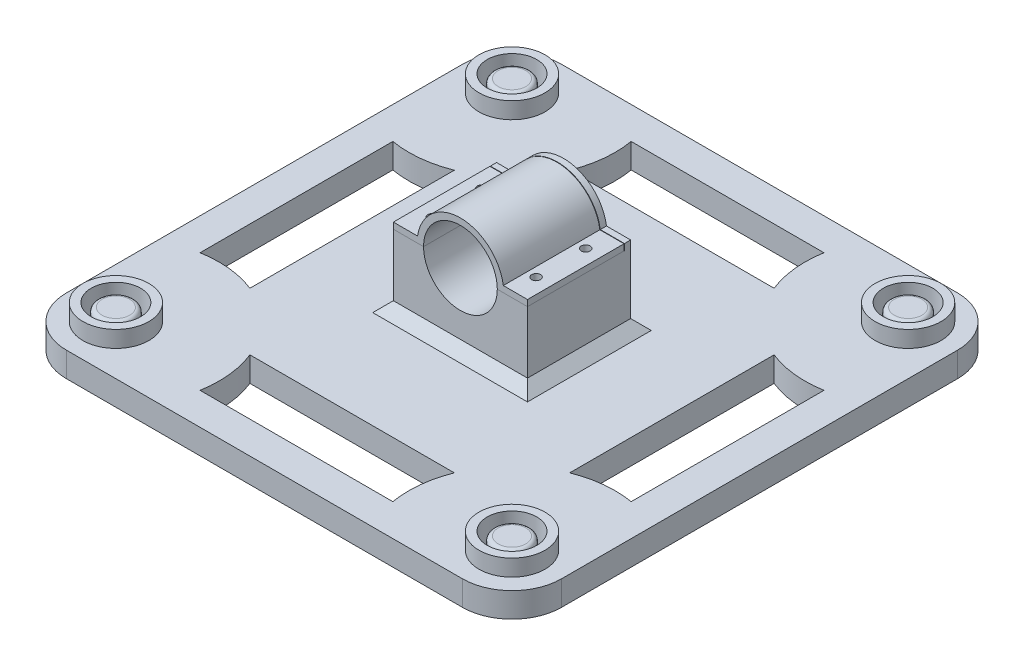
from build123d import *

# Parameters (mm, degrees)
SKETCH1_R           = 12
BOSS_EXTRUDE1_DEPTH = 12
SKETCH1_3_R         = 12
SKETCH1_3_R_2       = 8.7
BOSS_EXTRUDE2_DEPTH = 6
SKETCH1_4_R         = 8.7
BOSS_EXTRUDE3_DEPTH = 18
FILLET1_R           = 2
SKETCH2_R           = 16
SKETCH2_R_2         = 12
BOSS_EXTRUDE4_DEPTH = 8
SKETCH3_W           = 65
SKETCH3_H           = 15
BOSS_EXTRUDE5_DEPTH = 35
SKETCH10_W          = 65
SKETCH10_H          = 20
BOSS_EXTRUDE6_DEPTH = 35
SKETCH4_R           = 17.875
CUT_EXTRUDE1_DEPTH  = 49
CHAMFER1_SIZE       = 5
BOSS_EXTRUDE7_START = -3
SKETCH11_R          = 17.875
BOSS_EXTRUDE7_DEPTH = 3
SKETCH9_R           = 2.15
CUT_EXTRUDE2_DEPTH  = 8
SKETCH13_R          = 6.6
CUT_EXTRUDE3_DEPTH  = 8
SKETCH14_R          = 1.6
CUT_EXTRUDE4_DEPTH  = 8
BOSS_EXTRUDE8_DEPTH = 46.8
SKETCH16_R          = 2.15
CUT_EXTRUDE5_DEPTH  = 5.2
BOSS_EXTRUDE9_START = -3
BOSS_EXTRUDE9_DEPTH = 3
CUT_EXTRUDE6_DEPTH  = 26.2


with BuildPart() as part:
    # Sketch1 → Boss-Extrude1 (new body)
    with BuildSketch(Plane(origin=(0, 0, 0), x_dir=(1, 0, 0), z_dir=(0, 1, 0))):
        with BuildLine():
            ThreePointArc((0, 216), (7.029437252, 232.970562748), (24, 240))
            Line((24, 240), (216, 240))
            ThreePointArc((216, 240), (232.970562748, 232.970562748), (240, 216))
            Line((240, 216), (240, 24))
            ThreePointArc((240, 24), (232.970562748, 7.029437252), (216, 0))
            Line((216, 0), (24, 0))
            ThreePointArc((24, 0), (7.029437252, 7.029437252), (0, 24))
            Line((0, 24), (0, 216))
        make_face()
        with Locations(Location((24, 24, 0), (0, 0, 270))):
            Circle(SKETCH1_R, mode=Mode.SUBTRACT)
        with Locations(Location((216, 24, 0), (0, 0, 270))):
            Circle(SKETCH1_R, mode=Mode.SUBTRACT)
        with Locations(Location((216, 216, 0), (0, 0, 270))):
            Circle(SKETCH1_R, mode=Mode.SUBTRACT)
        with Locations(Location((24, 216, 0), (0, 0, 270))):
            Circle(SKETCH1_R, mode=Mode.SUBTRACT)
    extrude(amount=BOSS_EXTRUDE1_DEPTH)

    # Sketch1<3> → Boss-Extrude2 (add)
    # profile 1 of 4: a face of its own
    with BuildSketch(Plane(origin=(0, 0, 0), x_dir=(1, 0, 0), z_dir=(0, 1, 0))):
        with Locations(Location((24, 24, 0), (0, 0, 270))):
            Circle(SKETCH1_3_R)
        with Locations(Location((24, 24, 0), (0, 0, 270))):
            Circle(SKETCH1_3_R_2, mode=Mode.SUBTRACT)
    # profile 2 of 4: a face of its own
    with BuildSketch(Plane(origin=(0, 0, 0), x_dir=(1, 0, 0), z_dir=(0, 1, 0))):
        with Locations(Location((24, 216, 0), (0, 0, 270))):
            Circle(SKETCH1_3_R)
        with Locations(Location((24, 216, 0), (0, 0, 270))):
            Circle(SKETCH1_3_R_2, mode=Mode.SUBTRACT)
    # profile 3 of 4: a face of its own
    with BuildSketch(Plane(origin=(0, 0, 0), x_dir=(1, 0, 0), z_dir=(0, 1, 0))):
        with Locations(Location((216, 216, 0), (0, 0, 270))):
            Circle(SKETCH1_3_R)
        with Locations(Location((216, 216, 0), (0, 0, 270))):
            Circle(SKETCH1_3_R_2, mode=Mode.SUBTRACT)
    # profile 4 of 4: a face of its own
    with BuildSketch(Plane(origin=(0, 0, 0), x_dir=(1, 0, 0), z_dir=(0, 1, 0))):
        with Locations(Location((216, 24, 0), (0, 0, 270))):
            Circle(SKETCH1_3_R)
        with Locations(Location((216, 24, 0), (0, 0, 270))):
            Circle(SKETCH1_3_R_2, mode=Mode.SUBTRACT)
    extrude(amount=BOSS_EXTRUDE2_DEPTH)

    # Sketch1<4> → Boss-Extrude3 (add)
    with BuildSketch(Plane(origin=(0, 0, 0), x_dir=(1, 0, 0), z_dir=(0, 1, 0))):
        with Locations(Location((216, 216, 0), (0, 0, 270))):
            Circle(SKETCH1_4_R)
        with Locations(Location((216, 24, 0), (0, 0, 270))):
            Circle(SKETCH1_4_R)
        with Locations(Location((24, 24, 0), (0, 0, 270))):
            Circle(SKETCH1_4_R)
        with Locations(Location((24, 216, 0), (0, 0, 270))):
            Circle(SKETCH1_4_R)
    extrude(amount=BOSS_EXTRUDE3_DEPTH)

    # Fillet1
    fillet1_edges = [part.edges().sort_by_distance(p)[0] for p in [
        (216, 18, -224.7),
        (216, 18, -32.7),
        (24, 18, -32.7),
        (24, 18, -224.7),
    ]]
    fillet(fillet1_edges, radius=FILLET1_R)

    # Sketch2 → Boss-Extrude4 (add)
    # profile 1 of 4: a face of its own
    with BuildSketch(Plane(origin=(0, 12, 0), x_dir=(1, 0, 0), z_dir=(0, 1, 0))):
        with Locations(Location((24, 24, 0), (0, 0, 270))):
            Circle(SKETCH2_R)
        with Locations(Location((24, 24, 0), (0, 0, 270))):
            Circle(SKETCH2_R_2, mode=Mode.SUBTRACT)
    # profile 2 of 4: a face of its own
    with BuildSketch(Plane(origin=(0, 12, 0), x_dir=(1, 0, 0), z_dir=(0, 1, 0))):
        with Locations(Location((216, 24, 0), (0, 0, 270))):
            Circle(SKETCH2_R)
        with Locations(Location((216, 24, 0), (0, 0, 270))):
            Circle(SKETCH2_R_2, mode=Mode.SUBTRACT)
    # profile 3 of 4: a face of its own
    with BuildSketch(Plane(origin=(0, 12, 0), x_dir=(1, 0, 0), z_dir=(0, 1, 0))):
        with Locations(Location((216, 216, 0), (0, 0, 270))):
            Circle(SKETCH2_R)
        with Locations(Location((216, 216, 0), (0, 0, 270))):
            Circle(SKETCH2_R_2, mode=Mode.SUBTRACT)
    # profile 4 of 4: a face of its own
    with BuildSketch(Plane(origin=(0, 12, 0), x_dir=(1, 0, 0), z_dir=(0, 1, 0))):
        with Locations(Location((24, 216, 0), (0, 0, 270))):
            Circle(SKETCH2_R)
        with Locations(Location((24, 216, 0), (0, 0, 270))):
            Circle(SKETCH2_R_2, mode=Mode.SUBTRACT)
    extrude(amount=BOSS_EXTRUDE4_DEPTH)

    # Sketch3 → Boss-Extrude5 (add)
    with BuildSketch(Plane(origin=(0, 12, 0), x_dir=(1, 0, 0), z_dir=(0, 1, 0))):
        with Locations((120, 137.5)):
            Rectangle(SKETCH3_W, SKETCH3_H)
        with Locations((120, 102.5)):
            Rectangle(SKETCH3_W, SKETCH3_H)
    extrude(amount=BOSS_EXTRUDE5_DEPTH)

    # Sketch10 → Boss-Extrude6 (add)
    with BuildSketch(Plane(origin=(0, 12, 0), x_dir=(1, 0, 0), z_dir=(0, 1, 0))):
        with Locations((120, 120)):
            Rectangle(SKETCH10_W, SKETCH10_H)
    extrude(amount=BOSS_EXTRUDE6_DEPTH)

    # Sketch4 → Cut-Extrude1 (cut)
    with BuildSketch(Plane.XY.offset(-95)):
        with Locations((120, 47)):
            Circle(SKETCH4_R)
    extrude(amount=-CUT_EXTRUDE1_DEPTH, mode=Mode.SUBTRACT)

    # Chamfer1
    chamfer1_edges = [part.edges().sort_by_distance(p)[0] for p in [
        (87.5, 12, -120),
        (152.5, 12, -120),
        (120, 12, -145),
        (120, 12, -95),
    ]]
    chamfer(chamfer1_edges, length=CHAMFER1_SIZE)

    # Sketch11 → Boss-Extrude7 (add)
    with BuildSketch(Plane(origin=(0, 0, -145), x_dir=(-1, 0, 0), z_dir=(0, 0, -1)).offset(BOSS_EXTRUDE7_START)):
        with Locations((-120, 47)):
            Circle(SKETCH11_R)
    extrude(amount=BOSS_EXTRUDE7_DEPTH)

    # Sketch9 → Cut-Extrude2 (cut)
    with BuildSketch(Plane(origin=(0, 47, 0), x_dir=(1, 0, 0), z_dir=(0, 1, 0))):
        with Locations(Location((145.1875, 106.464105431, 0), (0, 0, 270))):
            Circle(SKETCH9_R)
        with Locations(Location((94.8125, 106.464105431, 0), (0, 0, 270))):
            Circle(SKETCH9_R)
        with Locations(Location((145.1875, 130.535894569, 0), (0, 0, 270))):
            Circle(SKETCH9_R)
        with Locations(Location((94.8125, 130.535894569, 0), (0, 0, 270))):
            Circle(SKETCH9_R)
    extrude(amount=-CUT_EXTRUDE2_DEPTH, mode=Mode.SUBTRACT)

    # Sketch13 → Cut-Extrude3 (cut)
    with BuildSketch(Plane.XY.offset(-142)):
        with Locations((120, 47)):
            Circle(SKETCH13_R)
    extrude(amount=-CUT_EXTRUDE3_DEPTH, mode=Mode.SUBTRACT)

    # Sketch14 → Cut-Extrude4 (cut)
    with BuildSketch(Plane.XY.offset(-142)):
        with Locations((132.5, 47)):
            Circle(SKETCH14_R)
        with Locations((107.5, 47)):
            Circle(SKETCH14_R)
    extrude(amount=-CUT_EXTRUDE4_DEPTH, mode=Mode.SUBTRACT)

    # Sketch17 → Boss-Extrude9 (add)
    with BuildSketch(Plane(origin=(0, 0, -145), x_dir=(-1, 0, 0), z_dir=(0, 0, -1)).offset(BOSS_EXTRUDE9_START)):
        with BuildLine():
            Line((-87.5, 47), (-87.5, 50))
            Line((-87.5, 50), (-99.215390309, 50))
            ThreePointArc((-99.215390309, 50), (-120, 68), (-140.784609691, 50))
            Line((-140.784609691, 50), (-152.5, 50))
            Line((-152.5, 50), (-152.5, 47))
            Line((-152.5, 47), (-137.875, 47))
            ThreePointArc((-137.875, 47), (-120, 64.875), (-102.125, 47))
            Line((-102.125, 47), (-87.5, 47))
        make_face()
    extrude(amount=BOSS_EXTRUDE9_DEPTH)

    # Sketch19 → Cut-Extrude6 (cut)
    with BuildSketch(Plane(origin=(0, 12, 0), x_dir=(1, 0, 0), z_dir=(0, 1, 0))):
        with BuildLine():
            Line((70.451587702, 197.5), (169.548412298, 197.5))
            ThreePointArc((169.548412298, 197.5), (166.271398516, 210.797481909), (166.725260021, 224.485281374))
            Line((166.725260021, 224.485281374), (73.274739979, 224.485281374))
            ThreePointArc((73.274739979, 224.485281374), (73.728601484, 210.797481909), (70.451587702, 197.5))
        make_face()
        with BuildLine():
            Line((42.5, 169.548412298), (42.5, 70.451587702))
            ThreePointArc((42.5, 70.451587702), (29.202518091, 73.728601484), (15.514718626, 73.274739979))
            Line((15.514718626, 73.274739979), (15.514718626, 166.725260021))
            ThreePointArc((15.514718626, 166.725260021), (29.202518091, 166.271398516), (42.5, 169.548412298))
        make_face()
        with BuildLine():
            Line((70.451587702, 42.5), (169.548412298, 42.5))
            ThreePointArc((169.548412298, 42.5), (166.271398516, 29.202518091), (166.725260021, 15.514718626))
            Line((166.725260021, 15.514718626), (73.274739979, 15.514718626))
            ThreePointArc((73.274739979, 15.514718626), (73.728601484, 29.202518091), (70.451587702, 42.5))
        make_face()
        with BuildLine():
            Line((197.5, 169.548412298), (197.5, 70.451587702))
            ThreePointArc((197.5, 70.451587702), (210.797481909, 73.728601484), (224.485281374, 73.274739979))
            Line((224.485281374, 73.274739979), (224.485281374, 166.725260021))
            ThreePointArc((224.485281374, 166.725260021), (210.797481909, 166.271398516), (197.5, 169.548412298))
        make_face()
    extrude(amount=-CUT_EXTRUDE6_DEPTH, mode=Mode.SUBTRACT)


with BuildPart() as body_2:
    # Sketch15 → Boss-Extrude8 (new body)
    with BuildSketch(Plane.XY.offset(-95)):
        with BuildLine():
            Line((87.5, 47), (102.125, 47))
            ThreePointArc((102.125, 47), (120, 64.875), (137.875, 47))
            Line((137.875, 47), (152.5, 47))
            Line((152.5, 47), (152.5, 50))
            Line((152.5, 50), (140.784609691, 50))
            ThreePointArc((140.784609691, 50), (120, 68), (99.215390309, 50))
            Line((99.215390309, 50), (87.5, 50))
            Line((87.5, 50), (87.5, 47))
        make_face()
    extrude(amount=-BOSS_EXTRUDE8_DEPTH)

    # Sketch16 → Cut-Extrude5 (cut)
    with BuildSketch(Plane(origin=(0, 50, 0), x_dir=(1, 0, 0), z_dir=(0, 1, 0))):
        with Locations(Location((145.1875, 130.535894569, 0), (0, 0, 270))):
            Circle(SKETCH16_R)
        with Locations(Location((94.8125, 106.464105431, 0), (0, 0, 270))):
            Circle(SKETCH16_R)
        with Locations(Location((145.1875, 106.464105431, 0), (0, 0, 270))):
            Circle(SKETCH16_R)
        with Locations(Location((94.8125, 130.535894569, 0), (0, 0, 270))):
            Circle(SKETCH16_R)
    extrude(amount=-CUT_EXTRUDE5_DEPTH, mode=Mode.SUBTRACT)


solid = Compound([part.part, body_2.part])
